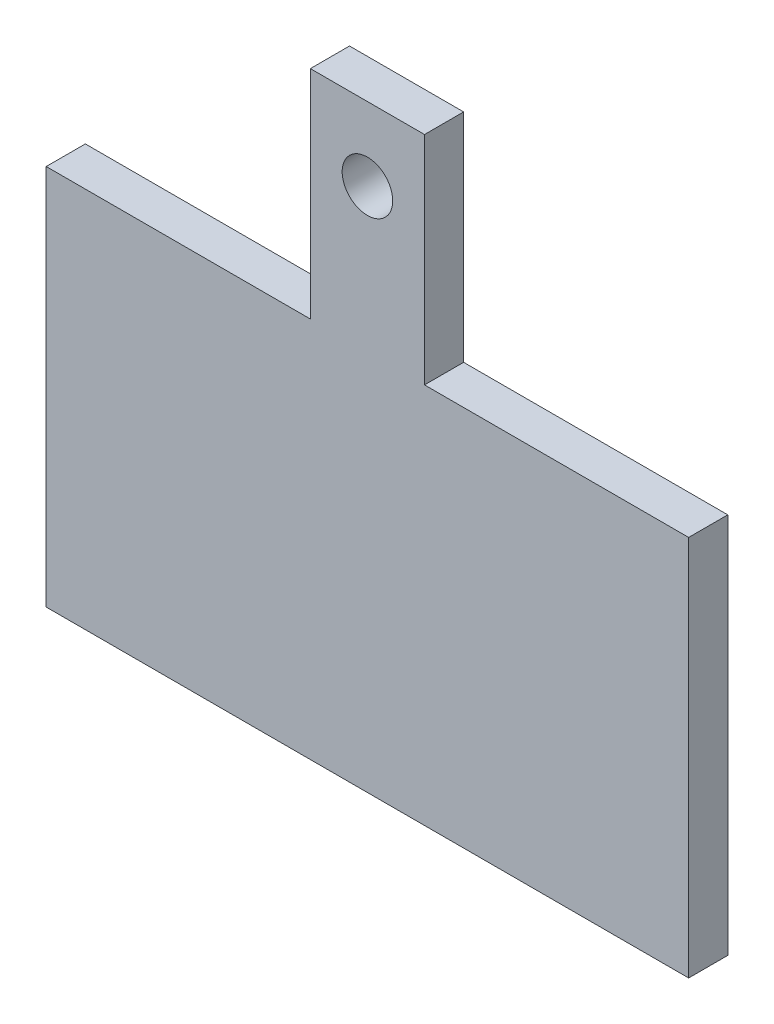
from build123d import *

# Parameters (mm, degrees)
SKETCH2_W            = 39.4
SKETCH2_H            = 23.4
HATCH_PLATE_DEPTH    = 2.4
SKETCH3_W            = 7
SKETCH3_H            = 14
SKETCH3_R            = 1.55
DRIVE_ARM_D3P1_DEPTH = 2.4


with BuildPart() as part:
    # Sketch2 → Hatch_plate (new body)
    with BuildSketch(Plane.XY):
        Rectangle(SKETCH2_W, SKETCH2_H)
    extrude(amount=HATCH_PLATE_DEPTH)

    # Sketch3 → Drive_arm_D3p1 (add)
    with BuildSketch(Plane.XY):
        with Locations((0, 18)):
            Rectangle(SKETCH3_W, SKETCH3_H)
        with Locations((0, 20.5)):
            Circle(SKETCH3_R, mode=Mode.SUBTRACT)
    extrude(amount=DRIVE_ARM_D3P1_DEPTH)


solid = part.part
